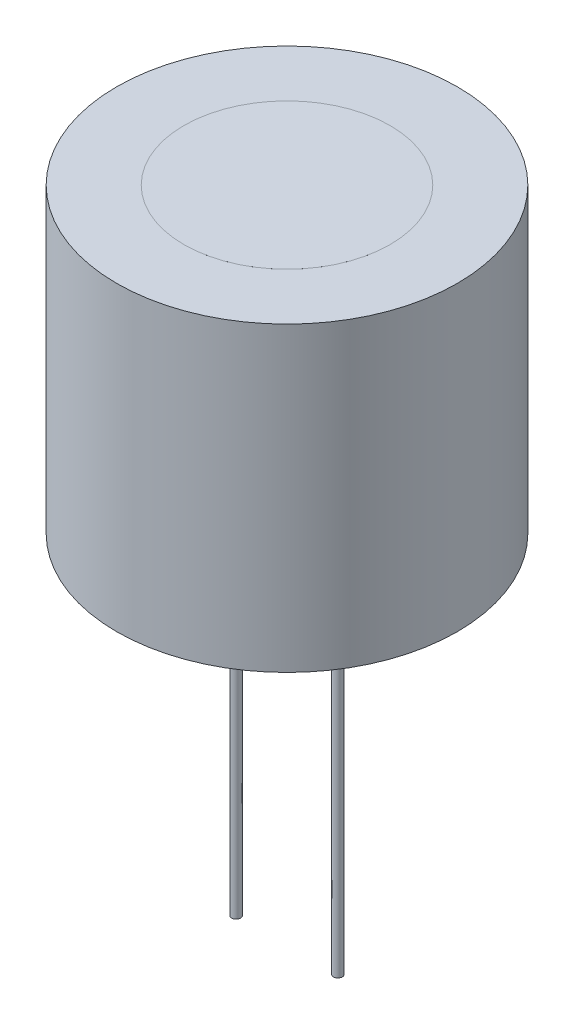
from build123d import *

# Parameters (mm, degrees)
SKETCH1_R           = 8.4963
BOSS_EXTRUDE1_DEPTH = 15.0495
SKETCH3_R           = 0.22225
BOSS_EXTRUDE2_DEPTH = 17.78
SKETCH2_R           = 5.1435
BOSS_EXTRUDE3_DEPTH = 0.000254


with BuildPart() as part:
    # Sketch1 → Boss-Extrude1 (new body)
    with BuildSketch(Plane(origin=(0, 0, 0), x_dir=(1, 0, 0), z_dir=(0, 1, 0))):
        with Locations(Location((0, 0, 0), (0, 0, 270))):
            Circle(SKETCH1_R)
    extrude(amount=-BOSS_EXTRUDE1_DEPTH)

    # Sketch3 → Boss-Extrude2 (add)
    with BuildSketch(Plane(origin=(0, -15.0495, 0), x_dir=(-1, 0, 0), z_dir=(0, -1, 0))):
        with Locations(Location((2.54, 0, 0), (0, 0, 270))):
            Circle(SKETCH3_R)
        with Locations(Location((-2.54, 0, 0), (0, 0, 270))):
            Circle(SKETCH3_R)
    extrude(amount=BOSS_EXTRUDE2_DEPTH)

    # Sketch2 → Boss-Extrude3 (add)
    with BuildSketch(Plane(origin=(0, 0, 0), x_dir=(1, 0, 0), z_dir=(0, 1, 0))):
        with Locations(Location((0, 0, 0), (0, 0, 270))):
            Circle(SKETCH2_R)
    extrude(amount=BOSS_EXTRUDE3_DEPTH)


solid = part.part
